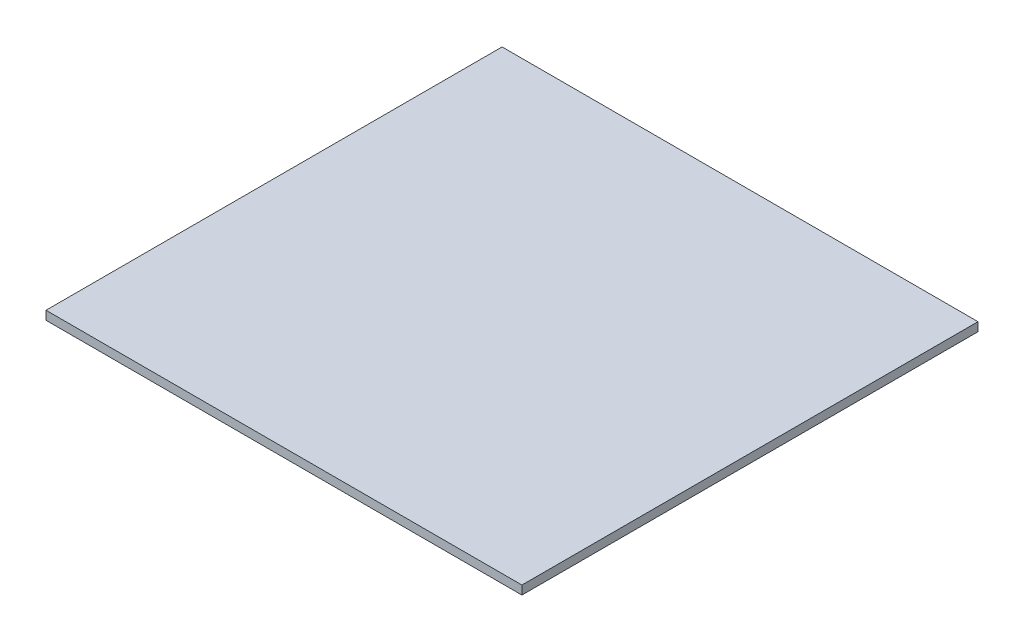
from build123d import *

# Parameters (mm, degrees)
SKETCH1_W           = 304.8
SKETCH1_H           = 292.1
BOSS_EXTRUDE1_DEPTH = 2.794


with BuildPart() as part:
    # Sketch1 → Boss-Extrude1 (new, symmetric)
    with BuildSketch(Plane(origin=(0, 0, 0), x_dir=(1, 0, 0), z_dir=(0, 1, 0))):
        Rectangle(SKETCH1_W, SKETCH1_H)
    extrude(amount=BOSS_EXTRUDE1_DEPTH, both=True)


solid = part.part
